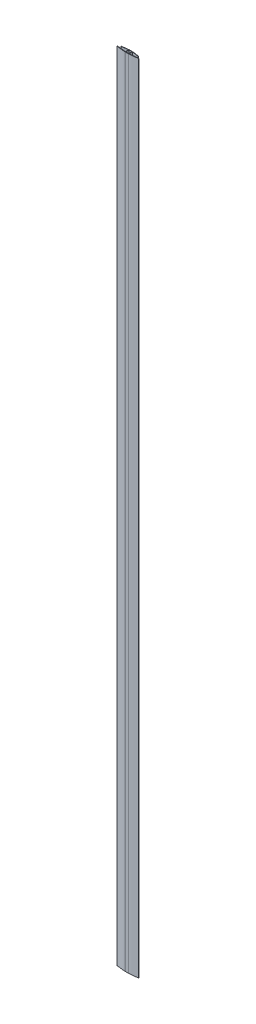
from build123d import *

# Parameters (mm, degrees)
BOSS_EXTRUDE1_DEPTH = 2693.01


with BuildPart() as part:
    # Sketch1 → Boss-Extrude1 (new body)
    with BuildSketch(Plane(origin=(0, 0, 0), x_dir=(1, 0, 0), z_dir=(0, 1, 0))):
        with BuildLine():
            Line((-6.2, -5.4), (-6.2, 5.4))
            add(Edge.make_bspline(
                [(-6.2, 5.4), (-9.679225222, 5.4), (-20.111968712, 3.681437455), (-28.193848075, 2.088954494), (-29.32220917, 2.215034077)],
                knots=[0, 0, 0, 0, 0.484752628, 0.969505256, 0.969505256, 0.969505256, 0.969505256], degree=3))
            ThreePointArc((-29.32220917, 2.215034077), (-29.449066821, 2.280458906), (-29.5, 2.413797134))
            Line((-29.5, 2.413797134), (-29.5, 3.21146772))
            ThreePointArc((-29.5, 3.21146772), (-29.434940138, 3.359086008), (-29.282088409, 3.410664042))
            add(Edge.make_bspline(
                [(-5, 6.6), (-9.207222053, 6.565902946), (-20.169116756, 4.865206686), (-28.102938907, 3.304635761), (-29.282088409, 3.410664042)],
                knots=[0, 0, 0, 0, 0.481875703, 0.963751406, 0.963751406, 0.963751406, 0.963751406], degree=3))
            Line((-5, 6.6), (0, 6.6))
            Line((0, 6.6), (5, 6.6))
            add(Edge.make_bspline(
                [(5, 6.6), (9.207222053, 6.565902946), (20.169116756, 4.865206686), (28.102938907, 3.304635761), (29.282088409, 3.410664042)],
                knots=[0, 0, 0, 0, 0.481875703, 0.963751406, 0.963751406, 0.963751406, 0.963751406], degree=3))
            ThreePointArc((29.282088409, 3.410664042), (29.434940138, 3.359086008), (29.5, 3.21146772))
            Line((29.5, 3.21146772), (29.5, 2.413797134))
            ThreePointArc((29.5, 2.413797134), (29.449066821, 2.280458906), (29.32220917, 2.215034077))
            add(Edge.make_bspline(
                [(6.2, 5.4), (9.679225222, 5.4), (20.111968712, 3.681437455), (28.193848075, 2.088954494), (29.32220917, 2.215034077)],
                knots=[0, 0, 0, 0, 0.484752628, 0.969505256, 0.969505256, 0.969505256, 0.969505256], degree=3))
            Line((6.2, 5.4), (6.2, -5.4))
            add(Edge.make_bspline(
                [(36, -2.25), (9.401491969, -5.379245875), (6.2, -5.4)],
                knots=[0, 0, 0, 1, 1, 1], degree=2))
            Line((36, -2.25), (36, -3.476707123))
            add(Edge.make_bspline(
                [(36, -3.476707123), (11.555997324, -6.849953306), (5.714958464, -6.629585165)],
                knots=[0, 0, 0, 1, 1, 1], degree=2))
            Line((5.714958464, -6.629585165), (5, -6.6))
            Line((5, -6.6), (0, -6.6))
            Line((0, -6.6), (-5, -6.6))
            Line((-5, -6.6), (-5.714958464, -6.629585165))
            add(Edge.make_bspline(
                [(-36, -3.476707123), (-11.555997324, -6.849953306), (-5.714958464, -6.629585165)],
                knots=[0, 0, 0, 1, 1, 1], degree=2))
            Line((-36, -3.476707123), (-36, -2.25))
            add(Edge.make_bspline(
                [(-36, -2.25), (-9.401491969, -5.379245875), (-6.2, -5.4)],
                knots=[0, 0, 0, 1, 1, 1], degree=2))
        make_face()
        Polygon((-5, -5.4), (-5, 5.4), (0, 5.4), (5, 5.4), (5, -5.4), (0, -5.4), align=None, mode=Mode.SUBTRACT)
    extrude(amount=BOSS_EXTRUDE1_DEPTH)


solid = part.part
